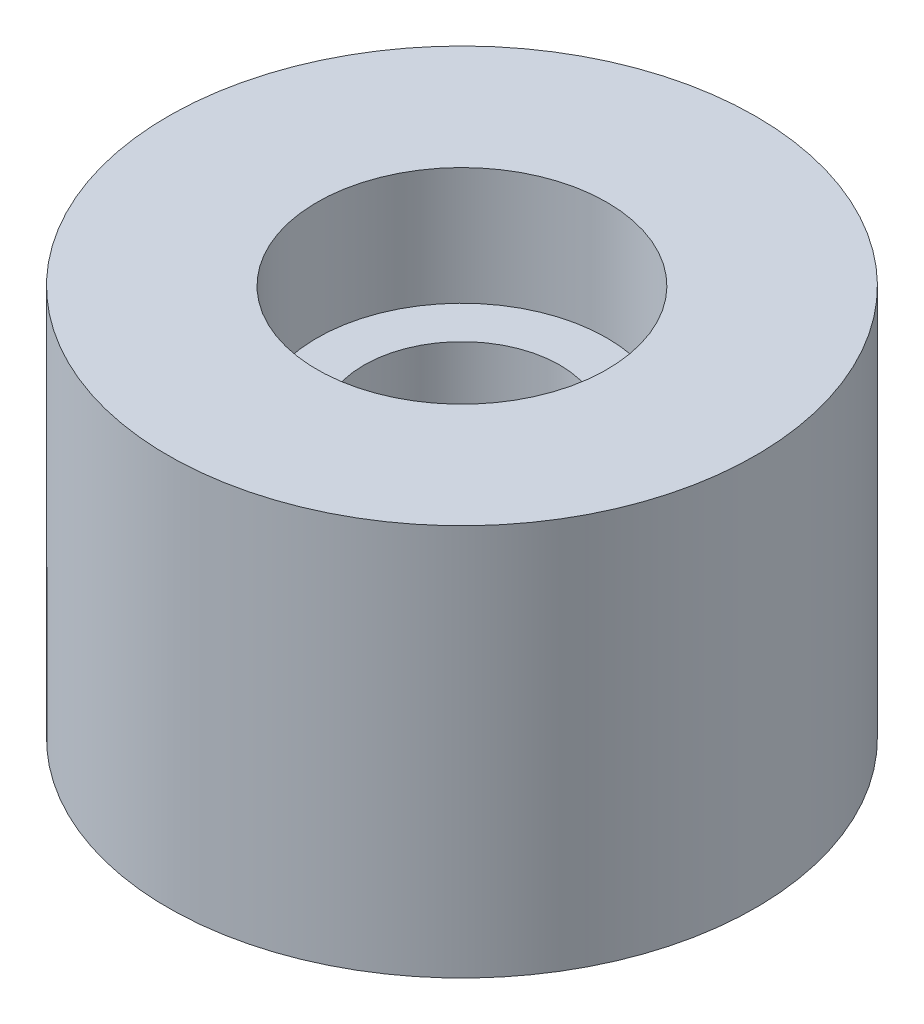
from build123d import *


with BuildPart() as part:
    # Sketch1 → Revolve1 (revolve)
    with BuildSketch(Plane.XY, mode=Mode.PRIVATE) as revolve1_sk:
        Polygon((-3.7, 0), (-7.5, 0), (-7.5, 0.5), (-7.5, 5.5), (-7.5, 10), (-3.7, 10), (-3.7, 7), (-2.5, 7), (-2.5, 3), (-3.7, 3), align=None)
    revolve(revolve1_sk.sketch.rotate(Axis((0, -6.629530881, 0), (0, 1, 0)), 270), axis=Axis((0, -6.629530881, 0), (0, 1, 0)))


solid = part.part
